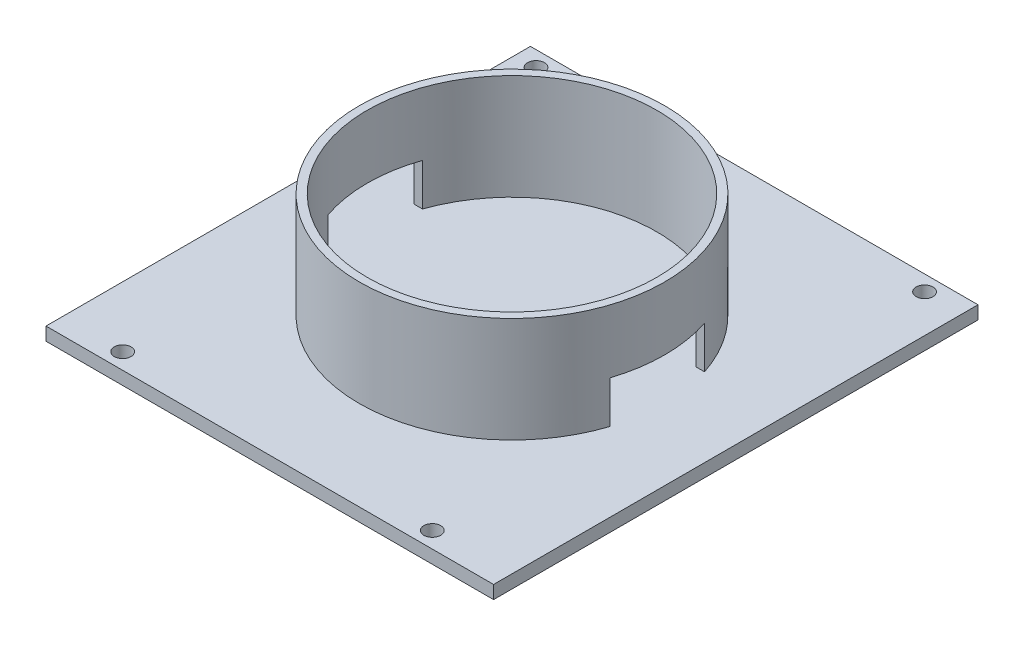
from build123d import *

# Parameters (mm, degrees)
EXTRUDE_1_DEPTH          = 2.5
SKETCH_4_R               = 1.6
CUT_EXTRUDE_1_DEPTH      = 2.5
SKETCH_6_R               = 29
SKETCH_6_R_2             = 27.5
EXTRUDE_2_DEPTH          = 20
CUT_EXTRUDE_2_DEPTH      = 86.473878076
CUT_EXTRUDE_2_DEPTH_BACK = 86.473878076
SKETCH_7_W               = 18
SKETCH_7_H               = 8


with BuildPart() as part:
    # 草图2 → 凸台-拉伸1 (new body)
    with BuildSketch(Plane(origin=(0, 0, 0), x_dir=(1, 0, 0), z_dir=(0, 1, 0))):
        Polygon((-42.5, 21.336828309), (42.5, 21.336828309), (42.5, -70.663171691), (32.5, -70.663171691), (-32.5, -70.663171691), (-42.5, -70.663171691), align=None)
    extrude(amount=EXTRUDE_1_DEPTH)

    # 草图4 → 切除-拉伸1 (cut)
    with BuildSketch(Plane(origin=(0, 2.5, 0), x_dir=(1, 0, 0), z_dir=(0, 1, 0))):
        with Locations(Location((-38.5, 18.393628901, 0), (0, 0, 270))):
            Circle(SKETCH_4_R)
        with Locations(Location((35.3, 18.393628901, 0), (0, 0, 270))):
            Circle(SKETCH_4_R)
        with Locations(Location((-31, -67.606371099, 0), (0, 0, 270))):
            Circle(SKETCH_4_R)
        with Locations(Location((27.8, -67.606371099, 0), (0, 0, 270))):
            Circle(SKETCH_4_R)
    extrude(amount=-CUT_EXTRUDE_1_DEPTH, mode=Mode.SUBTRACT)

    # 草图6 → 凸台-拉伸2 (add)
    with BuildSketch(Plane(origin=(0, 2.5, 0), x_dir=(1, 0, 0), z_dir=(0, 1, 0))):
        with Locations(Location((0, -24.663171691, 0), (0, 0, 270))):
            Circle(SKETCH_6_R)
        with Locations(Location((0, -24.663171691, 0), (0, 0, 270))):
            Circle(SKETCH_6_R_2, mode=Mode.SUBTRACT)
    extrude(amount=EXTRUDE_2_DEPTH)

    # 草图7 → 切除-拉伸2 (cut, two sides: drawn at the far end of the back side and taken through both)
    with BuildSketch(Plane(origin=(0, 0, 0), x_dir=(0, 0, -1), z_dir=(1, 0, 0)).offset(-CUT_EXTRUDE_2_DEPTH_BACK)):
        with Locations((-24.663171691, 6.5)):
            Rectangle(SKETCH_7_W, SKETCH_7_H)
    extrude(amount=CUT_EXTRUDE_2_DEPTH + CUT_EXTRUDE_2_DEPTH_BACK, mode=Mode.SUBTRACT)


solid = part.part
